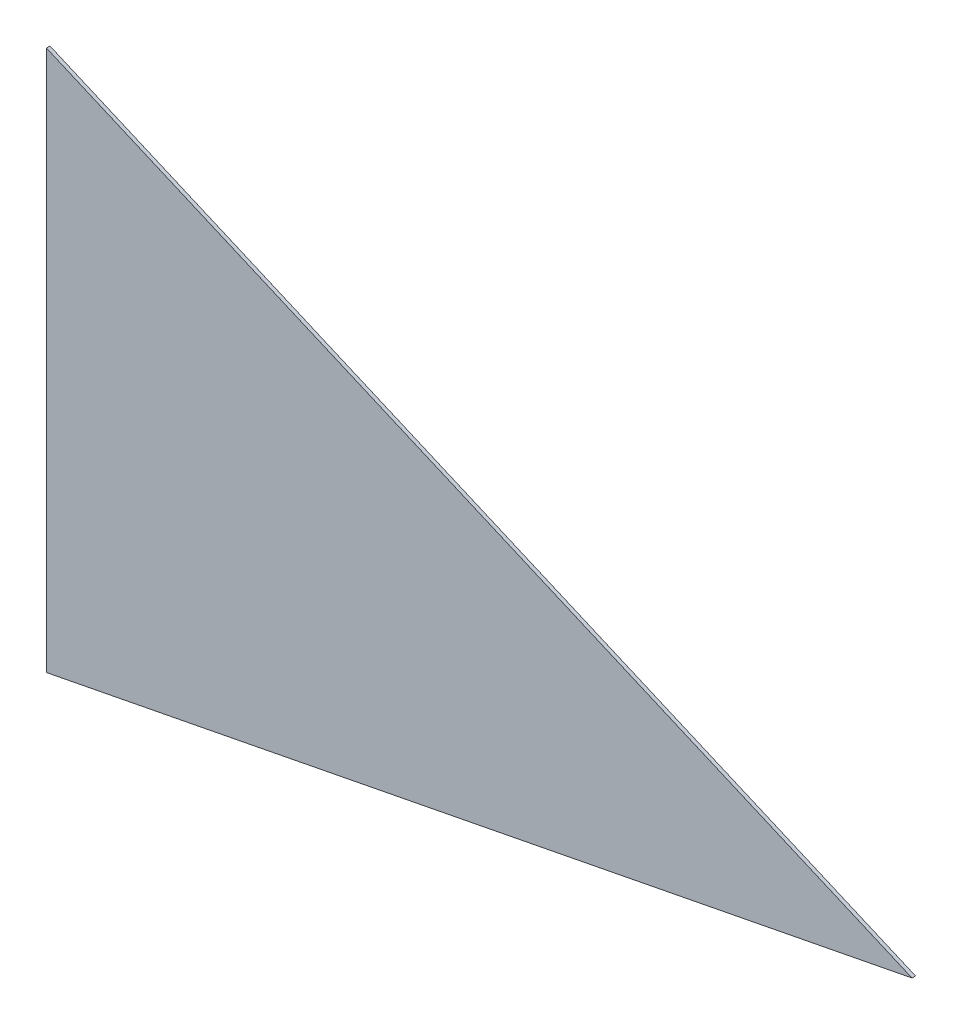
from build123d import *

# Parameters (mm, degrees)
BOSS_EXTRU_1_DEPTH = 3


with BuildPart() as part:
    # Esquisse1 → Boss.-Extru.1 (new body)
    with BuildSketch(Plane.XY):
        Polygon((0, 0), (0, 460), (736.220387586, 143.106746532), align=None)
    extrude(amount=BOSS_EXTRU_1_DEPTH)


solid = part.part
